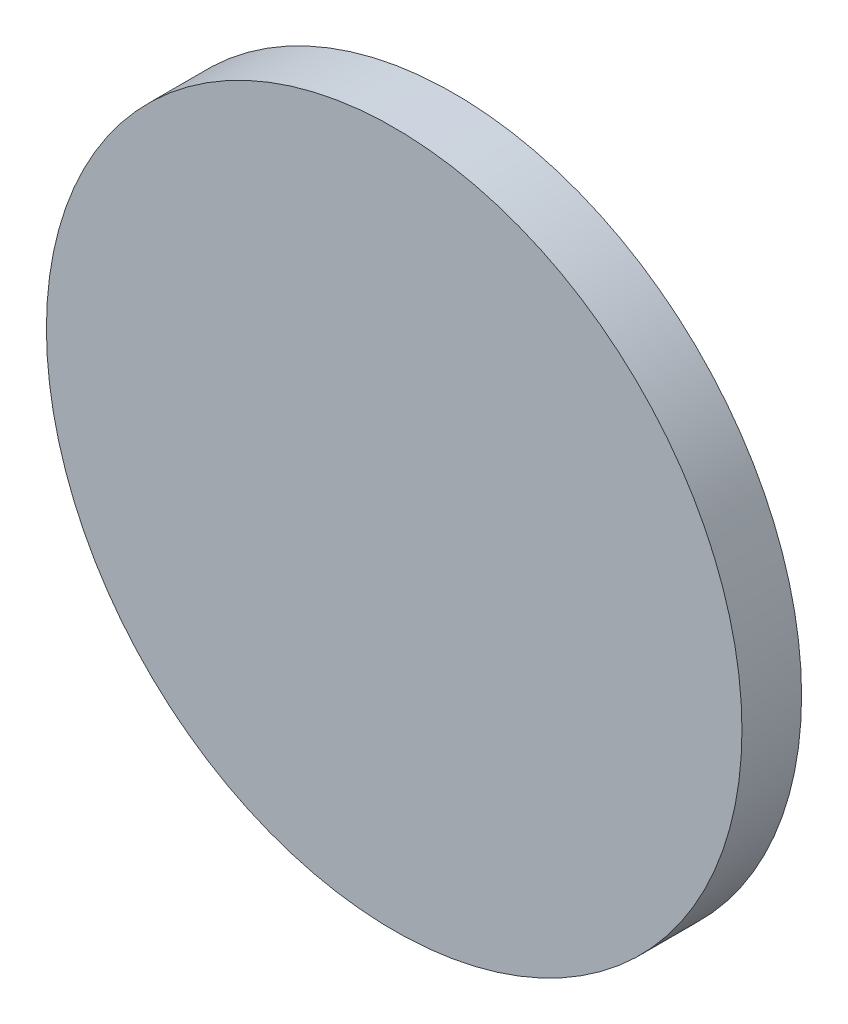
from build123d import *


with BuildPart() as part:
    # Sketch1 → Revolve2 (revolve)
    with BuildSketch(Plane(origin=(0, 0, 0), x_dir=(0, 0, -1), z_dir=(1, 0, 0)), mode=Mode.PRIVATE) as revolve2_sk:
        Polygon((0, 66.675), (11.43, 66.675), (11.43, 63.5), (5.08, 63.5), (5.08, 0), (0, 0), align=None)
    revolve(revolve2_sk.sketch.rotate(Axis((0, 0, 0), (0, 0, -1)), 90), axis=Axis((0, 0, 0), (0, 0, -1)))


solid = part.part
